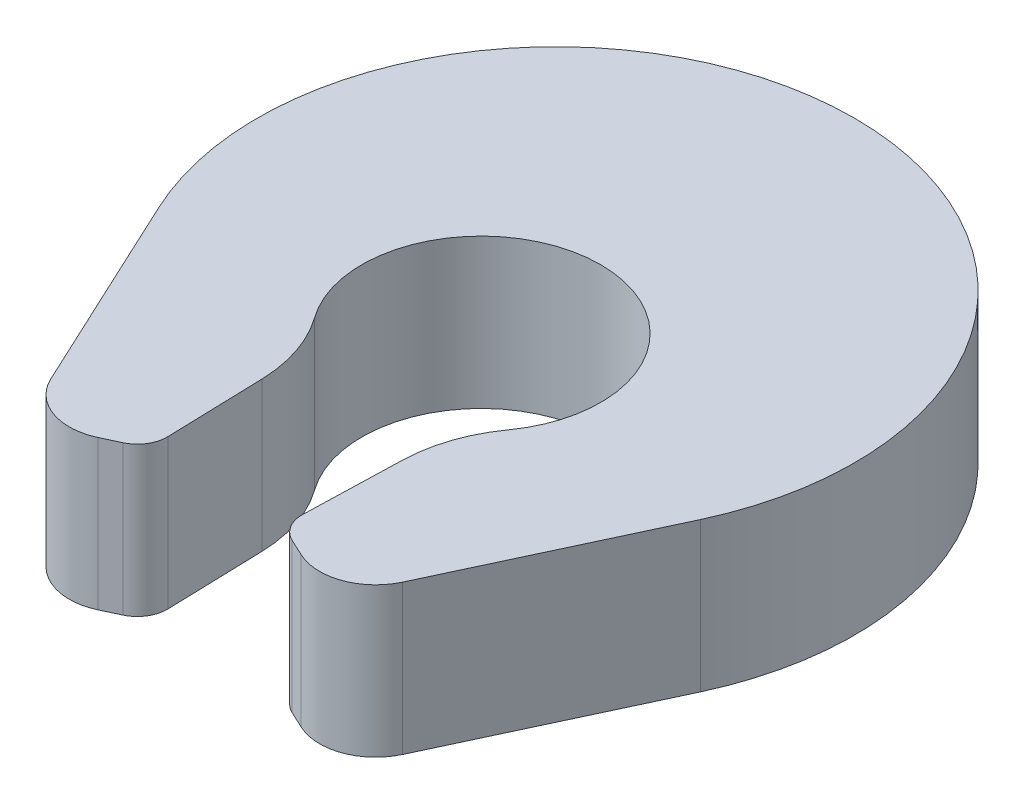
from build123d import *

# Parameters (mm, degrees)
BOSS_EXTRUDE1_DEPTH = 2


with BuildPart() as part:
    # Sketch2 → Boss-Extrude1 (new body)
    with BuildSketch(Plane(origin=(0, 0, 0), x_dir=(1, 0, 0), z_dir=(0, 1, 0))):
        with BuildLine():
            Line((-3.625231148, -1.690473047), (-2.357376363, -4.409396408))
            ThreePointArc((-2.357376363, -4.409396408), (-1.93416063, -4.797202177), (-1.360681826, -4.772163552))
            Line((-1.360681826, -4.772163552), (-1.13410488, -4.666508987))
            ThreePointArc((-1.13410488, -4.666508987), (-0.96265902, -4.513901105), (-0.903326596, -4.292174896))
            Line((-0.903326596, -4.292174896), (-0.941712266, -2.992741735))
            ThreePointArc((-0.941712266, -2.992741735), (-1.04172473, -2.435992925), (-1.3, -1.932737905))
            ThreePointArc((-1.3, -1.932737905), (0, 0.6), (1.3, -1.932737905))
            ThreePointArc((1.3, -1.932737905), (1.04172473, -2.435992925), (0.941712266, -2.992741735))
            Line((0.941712266, -2.992741735), (0.903326596, -4.292174896))
            ThreePointArc((0.903326596, -4.292174896), (0.96265902, -4.513901105), (1.13410488, -4.666508987))
            Line((1.13410488, -4.666508987), (1.360681826, -4.772163552))
            ThreePointArc((1.360681826, -4.772163552), (1.93416063, -4.797202177), (2.357376363, -4.409396408))
            Line((2.357376363, -4.409396408), (3.625231148, -1.690473047))
            ThreePointArc((3.625231148, -1.690473047), (0, 4), (-3.625231148, -1.690473047))
        make_face()
    extrude(amount=BOSS_EXTRUDE1_DEPTH)


solid = part.part
